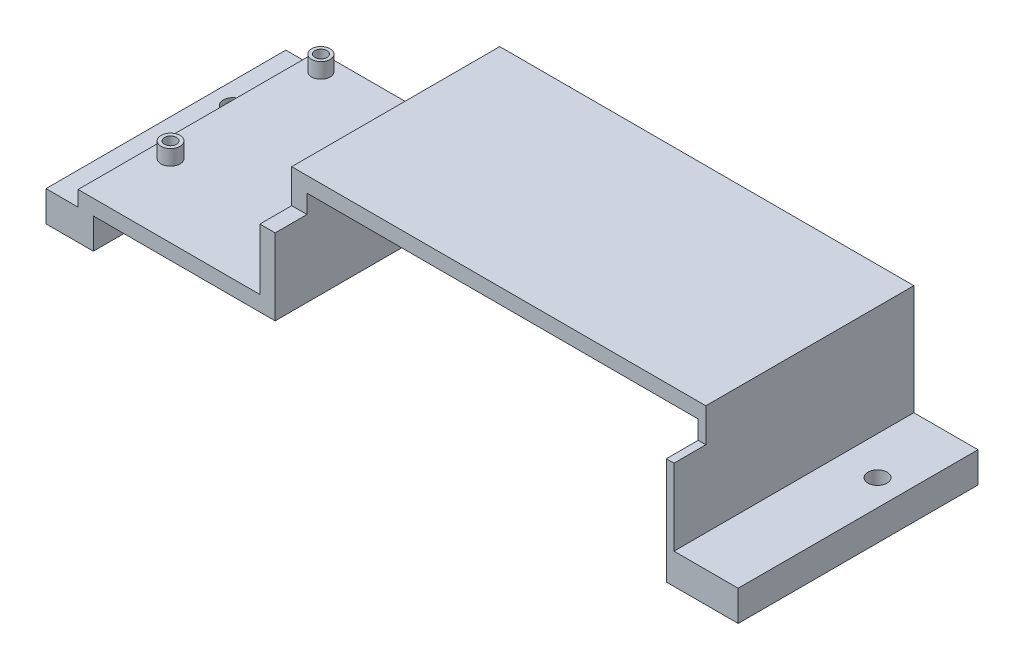
from build123d import *

# Parameters (mm, degrees)
BOSS_EXTRUDE1_DEPTH = 39.878
SKETCH3_R           = 1.5875
CUT_EXTRUDE1_DEPTH  = 90.788257027
SKETCH5_W           = 5.295414823
SKETCH5_H           = 5.612914704
CUT_EXTRUDE2_DEPTH  = 124.157023236
SKETCH6_R           = 1.576757794
SKETCH6_R_2         = 1
SKETCH6_R_3         = 1.536946723
SKETCH6_R_4         = 1.574598992
SKETCH6_R_5         = 1.626931784
BOSS_EXTRUDE3_DEPTH = 2.54


with BuildPart() as part:
    # Sketch2 → Boss-Extrude1 (new body)
    with BuildSketch(Plane.XY):
        Polygon((-30.226, 0), (-30.226, -5.08), (-38.1, -5.08), (-38.1, 0), (-32.766, 0), (-32.766, 2.54), (-2.54, 2.54), (-2.54, 18.288), (66.310002, 18.288), (66.310002, 0), (76.978002, 0), (76.978002, -5.08), (65.040002, -5.08), (65.040002, 15.748), (0, 15.748), (0, 0), align=None)
    extrude(amount=BOSS_EXTRUDE1_DEPTH)

    # Sketch3 → Cut-Extrude1 (cut, through all)
    with BuildSketch(Plane.XZ.offset(5.08)):
        with Locations((-34.544, 12.369063527)):
            Circle(SKETCH3_R)
        with Locations((72.644, 12.369063527)):
            Circle(SKETCH3_R)
    extrude(amount=-CUT_EXTRUDE1_DEPTH, mode=Mode.SUBTRACT)

    # Sketch5 → Cut-Extrude2 (cut, through all)
    with BuildSketch(Plane(origin=(76.978002, 0, 0), x_dir=(0, 0, -1), z_dir=(1, 0, 0))):
        with Locations((-37.230292589, 15.481542648)):
            Rectangle(SKETCH5_W, SKETCH5_H)
    extrude(amount=-CUT_EXTRUDE2_DEPTH, mode=Mode.SUBTRACT)

    # Sketch6 → Boss-Extrude3 (add)
    # profile 1 of 4: a face of its own
    with BuildSketch(Plane(origin=(0, 2.54, 0), x_dir=(1, 0, 0), z_dir=(0, 1, 0))):
        with Locations((-29.54, -27.73004556)):
            Circle(SKETCH6_R)
        with Locations(Location((-29.54, -27.73004556, 0), (0, 0, 180))):
            Circle(SKETCH6_R_2, mode=Mode.SUBTRACT)
    # profile 2 of 4: a face of its own
    with BuildSketch(Plane(origin=(0, 2.54, 0), x_dir=(1, 0, 0), z_dir=(0, 1, 0))):
        with Locations((-29.54, -2.73004556)):
            Circle(SKETCH6_R_3)
        with Locations(Location((-29.54, -2.73004556, 0), (0, 0, 180))):
            Circle(SKETCH6_R_2, mode=Mode.SUBTRACT)
    # profile 3 of 4: a face of its own
    with BuildSketch(Plane(origin=(0, 2.54, 0), x_dir=(1, 0, 0), z_dir=(0, 1, 0))):
        with Locations((-4.54, -27.73004556)):
            Circle(SKETCH6_R_4)
        with Locations(Location((-4.54, -27.73004556, 0), (0, 0, 180))):
            Circle(SKETCH6_R_2, mode=Mode.SUBTRACT)
    # profile 4 of 4: a face of its own
    with BuildSketch(Plane(origin=(0, 2.54, 0), x_dir=(1, 0, 0), z_dir=(0, 1, 0))):
        with Locations((-4.54, -2.73004556)):
            Circle(SKETCH6_R_5)
        with Locations(Location((-4.54, -2.73004556, 0), (0, 0, 180))):
            Circle(SKETCH6_R_2, mode=Mode.SUBTRACT)
    extrude(amount=BOSS_EXTRUDE3_DEPTH)


solid = part.part
